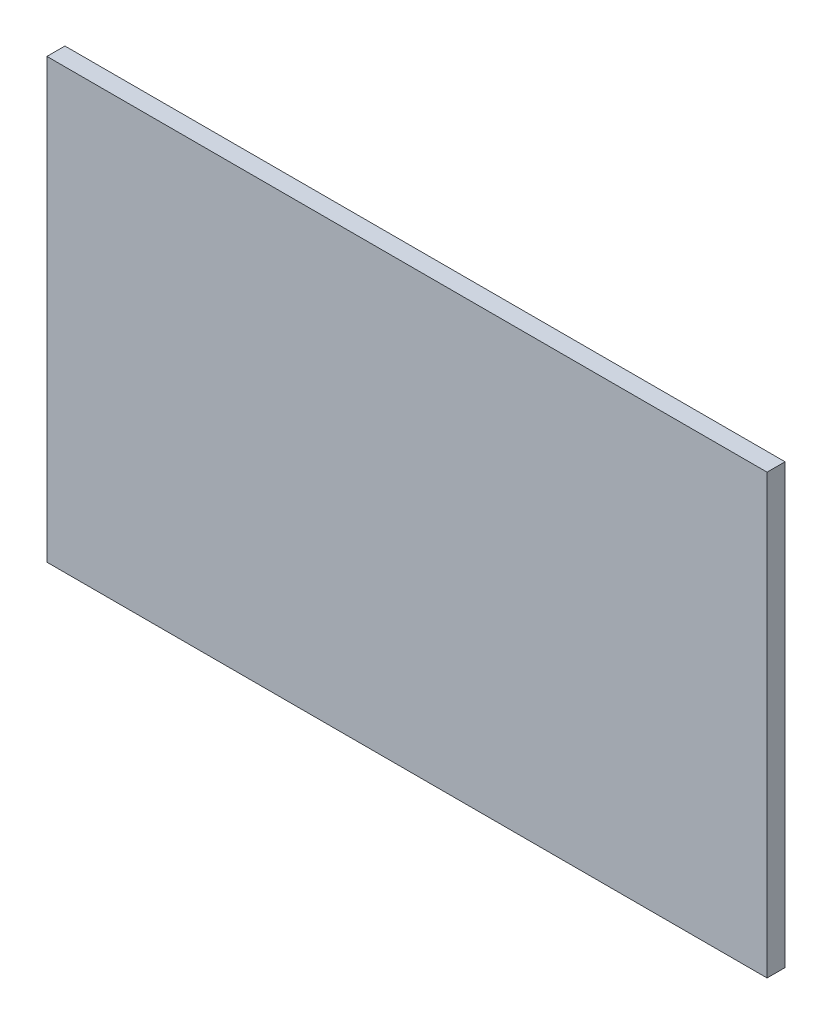
from build123d import *

# Parameters (mm, degrees)
SKETCH_1_W      = 120
SKETCH_1_H      = 73
EXTRUDE_1_DEPTH = 3


with BuildPart() as part:
    # 草图1 → 凸台-拉伸1 (new body)
    with BuildSketch(Plane.XY):
        Rectangle(SKETCH_1_W, SKETCH_1_H)
    extrude(amount=EXTRUDE_1_DEPTH)


solid = part.part
